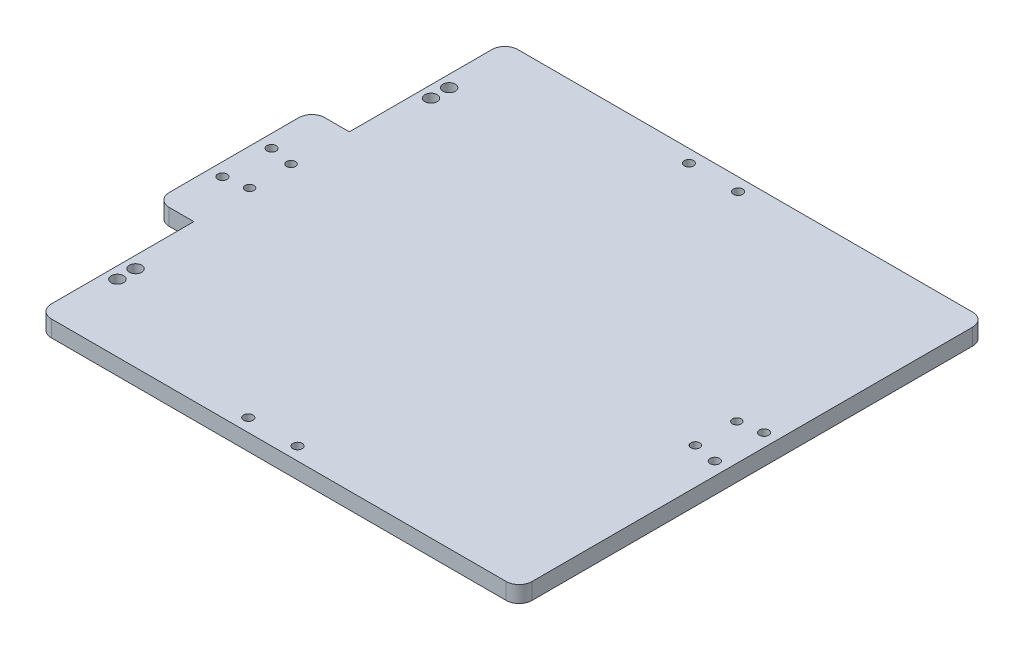
from build123d import *

# Parameters (mm, degrees)
SKETCH2_R           = 2.38125
SKETCH2_R_2         = 1.8
SKETCH2_R_3         = 1.7
BOSS_EXTRUDE1_DEPTH = 6.35
FILLET1_R           = 5


with BuildPart() as part:
    # Sketch2 → Boss-Extrude1 (new body)
    with BuildSketch(Plane(origin=(0, 0, 0), x_dir=(1, 0, 0), z_dir=(0, 1, 0))):
        Polygon((-85.5, -90), (100, -90), (100, 90), (-85.5, 90), (-85.5, 30.004081815), (-100, 30.004081815), (-100, -30.004081815), (-85.5, -30.004081815), align=None)
        with Locations(Location((-81, -64, 0), (0, 0, 270))):
            Circle(SKETCH2_R, mode=Mode.SUBTRACT)
        with Locations(Location((-81, -57, 0), (0, 0, 270))):
            Circle(SKETCH2_R, mode=Mode.SUBTRACT)
        with Locations(Location((-9.5, -85, 0), (0, 0, 270))):
            Circle(SKETCH2_R_2, mode=Mode.SUBTRACT)
        with Locations(Location((-95, -9.5, 0), (0, 0, 270))):
            Circle(SKETCH2_R_2, mode=Mode.SUBTRACT)
        with Locations(Location((-86, -8, 0), (0, 0, 270))):
            Circle(SKETCH2_R_3, mode=Mode.SUBTRACT)
        with Locations(Location((9.5, -85, 0), (0, 0, 270))):
            Circle(SKETCH2_R_2, mode=Mode.SUBTRACT)
        with Locations(Location((86, -8, 0), (0, 0, 270))):
            Circle(SKETCH2_R_3, mode=Mode.SUBTRACT)
        with Locations(Location((95, -9.5, 0), (0, 0, 270))):
            Circle(SKETCH2_R_2, mode=Mode.SUBTRACT)
        with Locations(Location((-95, 9.5, 0), (0, 0, 270))):
            Circle(SKETCH2_R_2, mode=Mode.SUBTRACT)
        with Locations(Location((-86, 8, 0), (0, 0, 270))):
            Circle(SKETCH2_R_3, mode=Mode.SUBTRACT)
        with Locations(Location((-81, 57, 0), (0, 0, 270))):
            Circle(SKETCH2_R, mode=Mode.SUBTRACT)
        with Locations(Location((-81, 64, 0), (0, 0, 270))):
            Circle(SKETCH2_R, mode=Mode.SUBTRACT)
        with Locations(Location((-9.5, 85, 0), (0, 0, 270))):
            Circle(SKETCH2_R_2, mode=Mode.SUBTRACT)
        with Locations(Location((86, 8, 0), (0, 0, 270))):
            Circle(SKETCH2_R_3, mode=Mode.SUBTRACT)
        with Locations(Location((95, 9.5, 0), (0, 0, 270))):
            Circle(SKETCH2_R_2, mode=Mode.SUBTRACT)
        with Locations(Location((9.5, 85, 0), (0, 0, 270))):
            Circle(SKETCH2_R_2, mode=Mode.SUBTRACT)
    extrude(amount=BOSS_EXTRUDE1_DEPTH)

    # Fillet1
    fillet1_edges = [part.edges().sort_by_distance(p)[0] for p in [
        (-100, 3.175, 30.004081815),
        (-100, 3.175, -30.004081815),
        (-85.5, 3.175, -90),
        (100, 3.175, -90),
        (100, 3.175, 90),
        (-85.5, 3.175, 90),
    ]]
    fillet(fillet1_edges, radius=FILLET1_R)


solid = part.part
